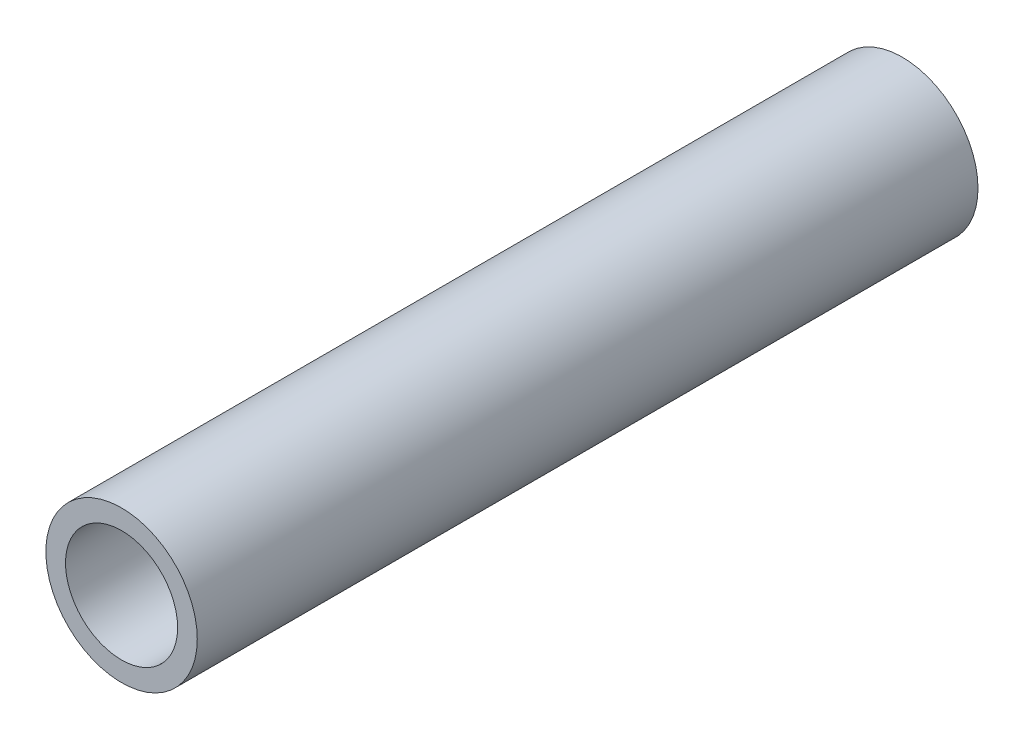
from build123d import *

# Parameters (mm, degrees)
SKETCH1_R           = 10.668
SKETCH1_R_2         = 7.8994
EXTRUDE_THIN1_DEPTH = 55


with BuildPart() as part:
    # Sketch1 → Extrude-Thin1 (new, symmetric)
    with BuildSketch(Plane.XY):
        Circle(SKETCH1_R)
        Circle(SKETCH1_R_2, mode=Mode.SUBTRACT)
    extrude(amount=EXTRUDE_THIN1_DEPTH, both=True)


solid = part.part
